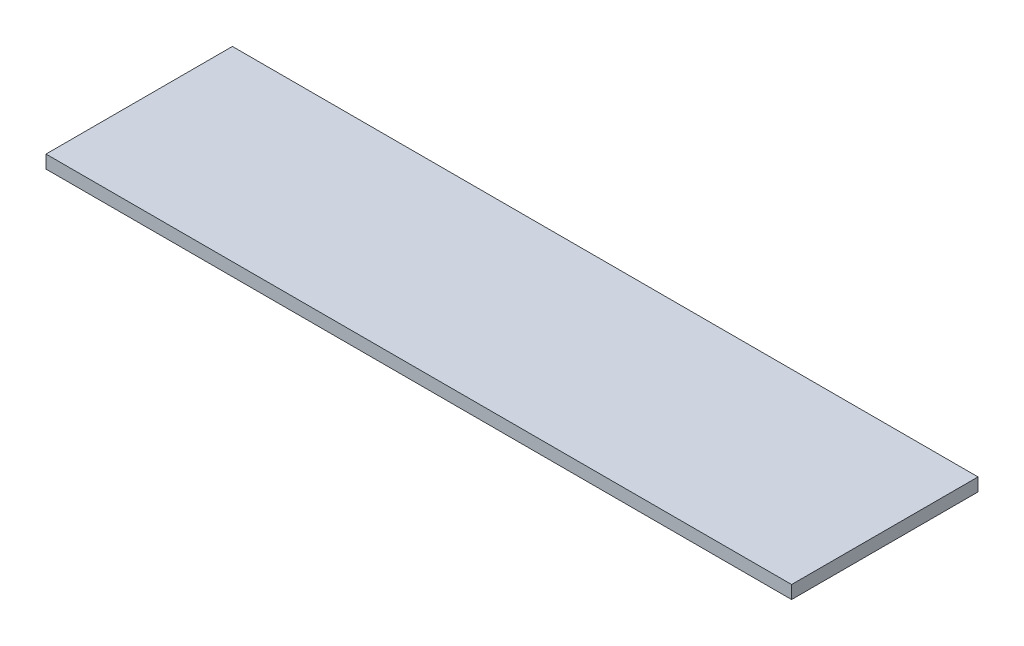
from build123d import *

# Parameters (mm, degrees)
SKETCH1_W           = 40
SKETCH1_H           = 10
BOSS_EXTRUDE1_DEPTH = 0.7


with BuildPart() as part:
    # Sketch1 → Boss-Extrude1 (new body)
    with BuildSketch(Plane(origin=(0, 0, 0), x_dir=(1, 0, 0), z_dir=(0, 1, 0))):
        Rectangle(SKETCH1_W, SKETCH1_H)
    extrude(amount=BOSS_EXTRUDE1_DEPTH)


solid = part.part
